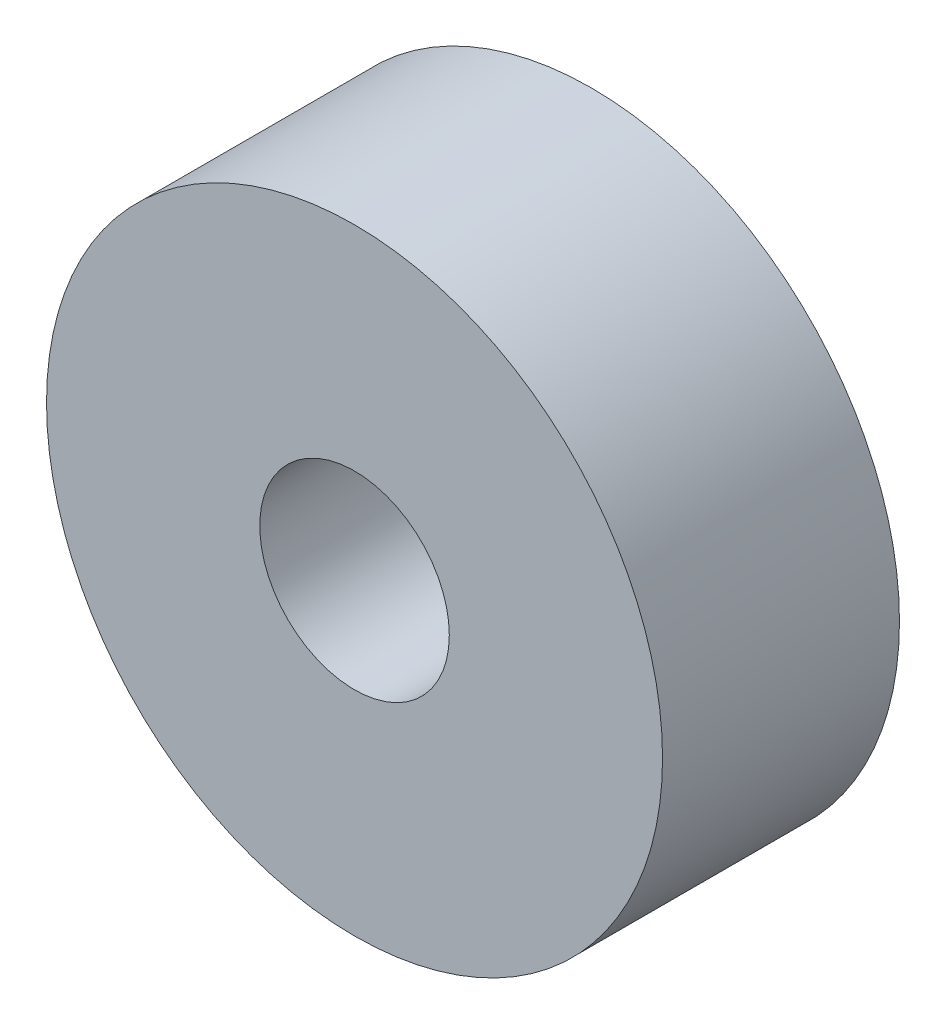
from build123d import *

# Parameters (mm, degrees)
SKETCH_1_R      = 6.5
SKETCH_1_R_2    = 2
EXTRUDE_1_DEPTH = 5


with BuildPart() as part:
    # 草图1 → 凸台-拉伸1 (new body)
    with BuildSketch(Plane.XY):
        Circle(SKETCH_1_R)
        Circle(SKETCH_1_R_2, mode=Mode.SUBTRACT)
    extrude(amount=EXTRUDE_1_DEPTH)


solid = part.part
